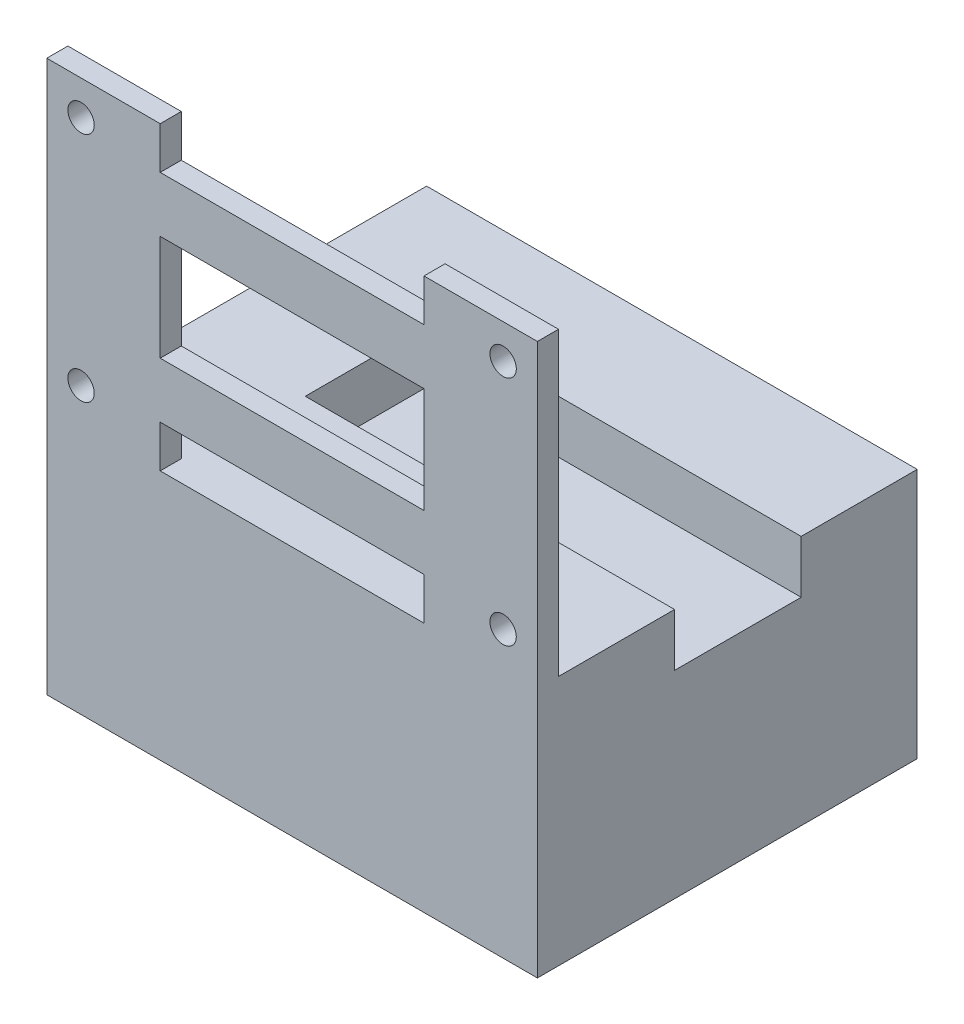
from build123d import *

# Parameters (mm, degrees)
SKETCH1_W           = 46.5
SKETCH1_H           = 34
BOSS_EXTRUDE1_DEPTH = 13.75
SKETCH2_W           = 46.5
SKETCH2_H           = 42.25
BOSS_EXTRUDE2_DEPTH = 2
CUT_EXTRUDE1_REACH  = 62.18
SKETCH3_R           = 1.25
SKETCH3_W           = 25
SKETCH3_H           = 10
SKETCH4_W           = 35
SKETCH4_H           = 12
CUT_EXTRUDE2_DEPTH  = 5
SKETCH6_W           = 46.5
SKETCH6_H           = 36
SKETCH6_R           = 2
BOSS_EXTRUDE3_DEPTH = 10
SKETCH7_W           = 25
SKETCH7_H           = 4
CUT_EXTRUDE3_DEPTH  = 10


with BuildPart() as part:
    # Sketch1 → Boss-Extrude1 (new body)
    with BuildSketch(Plane(origin=(0, 0, 0), x_dir=(1, 0, 0), z_dir=(0, 1, 0))):
        Rectangle(SKETCH1_W, SKETCH1_H)
    extrude(amount=BOSS_EXTRUDE1_DEPTH)

    # Sketch2 → Boss-Extrude2 (add)
    with BuildSketch(Plane.XY.offset(17)):
        with Locations((0, 21.125)):
            Rectangle(SKETCH2_W, SKETCH2_H)
    extrude(amount=BOSS_EXTRUDE2_DEPTH)

    # Sketch3 → Cut-Extrude1 (cut, up to next)
    with BuildSketch(Plane.XY.offset(19), mode=Mode.PRIVATE) as cut_extrude1_sk1:
        with Locations((-20, 39)):
            Circle(SKETCH3_R)
    cut_extrude1_tool1 = extrude(cut_extrude1_sk1.sketch, amount=-CUT_EXTRUDE1_REACH, mode=Mode.PRIVATE) & part.part
    # Sketch3 → Cut-Extrude1 (cut, up to next)
    with BuildSketch(Plane.XY.offset(19), mode=Mode.PRIVATE) as cut_extrude1_sk2:
        with Locations(Location((20, 39, 0), (0, 0, 180))):
            Circle(SKETCH3_R)
    cut_extrude1_tool2 = extrude(cut_extrude1_sk2.sketch, amount=-CUT_EXTRUDE1_REACH, mode=Mode.PRIVATE) & part.part
    # Sketch3 → Cut-Extrude1 (cut, up to next)
    with BuildSketch(Plane.XY.offset(19), mode=Mode.PRIVATE) as cut_extrude1_sk3:
        with Locations((20, 17)):
            Circle(SKETCH3_R)
    cut_extrude1_tool3 = extrude(cut_extrude1_sk3.sketch, amount=-CUT_EXTRUDE1_REACH, mode=Mode.PRIVATE) & part.part
    # Sketch3 → Cut-Extrude1 (cut, up to next)
    with BuildSketch(Plane.XY.offset(19), mode=Mode.PRIVATE) as cut_extrude1_sk4:
        with Locations(Location((-20, 17, 0), (0, 0, 180))):
            Circle(SKETCH3_R)
    cut_extrude1_tool4 = extrude(cut_extrude1_sk4.sketch, amount=-CUT_EXTRUDE1_REACH, mode=Mode.PRIVATE) & part.part
    # Sketch3 → Cut-Extrude1 (cut, up to next)
    with BuildSketch(Plane.XY.offset(19), mode=Mode.PRIVATE) as cut_extrude1_sk5:
        with Locations((0, 28)):
            Rectangle(SKETCH3_W, SKETCH3_H)
    cut_extrude1_tool5 = extrude(cut_extrude1_sk5.sketch, amount=-CUT_EXTRUDE1_REACH, mode=Mode.PRIVATE) & part.part
    add(cut_extrude1_tool1.solids().sort_by_distance((-20, 39, 19))[0], mode=Mode.SUBTRACT)
    add(cut_extrude1_tool2.solids().sort_by_distance((20, 39, 19))[0], mode=Mode.SUBTRACT)
    add(cut_extrude1_tool3.solids().sort_by_distance((20, 17, 19))[0], mode=Mode.SUBTRACT)
    add(cut_extrude1_tool4.solids().sort_by_distance((-20, 17, 19))[0], mode=Mode.SUBTRACT)
    add(cut_extrude1_tool5.solids().sort_by_distance((0, 28, 19))[0], mode=Mode.SUBTRACT)

    # Sketch4 → Cut-Extrude2 (cut)
    with BuildSketch(Plane(origin=(0, 13.75, 0), x_dir=(1, 0, 0), z_dir=(0, 1, 0))):
        with Locations((5.75, 0)):
            Rectangle(SKETCH4_W, SKETCH4_H)
    extrude(amount=-CUT_EXTRUDE2_DEPTH, mode=Mode.SUBTRACT)

    # Sketch6 → Boss-Extrude3 (add)
    with BuildSketch(Plane.XZ):
        with Locations((0, 1)):
            Rectangle(SKETCH6_W, SKETCH6_H)
        with Locations(Location((16.25, -10, 0), (0, 0, 270))):
            Circle(SKETCH6_R, mode=Mode.SUBTRACT)
        with Locations(Location((-16.25, -10, 0), (0, 0, 270))):
            Circle(SKETCH6_R, mode=Mode.SUBTRACT)
        with Locations(Location((-16.25, 12, 0), (0, 0, 270))):
            Circle(SKETCH6_R, mode=Mode.SUBTRACT)
        with Locations(Location((16.25, 12, 0), (0, 0, 270))):
            Circle(SKETCH6_R, mode=Mode.SUBTRACT)
    extrude(amount=BOSS_EXTRUDE3_DEPTH)

    # Sketch7 → Cut-Extrude3 (cut)
    with BuildSketch(Plane(origin=(0, 0, 17), x_dir=(-1, 0, 0), z_dir=(0, 0, -1))):
        with Locations((0, 15.75)):
            Rectangle(SKETCH7_W, SKETCH7_H)
        with Locations((0, 40.25)):
            Rectangle(SKETCH7_W, SKETCH7_H)
    extrude(amount=-CUT_EXTRUDE3_DEPTH, mode=Mode.SUBTRACT)


solid = part.part
